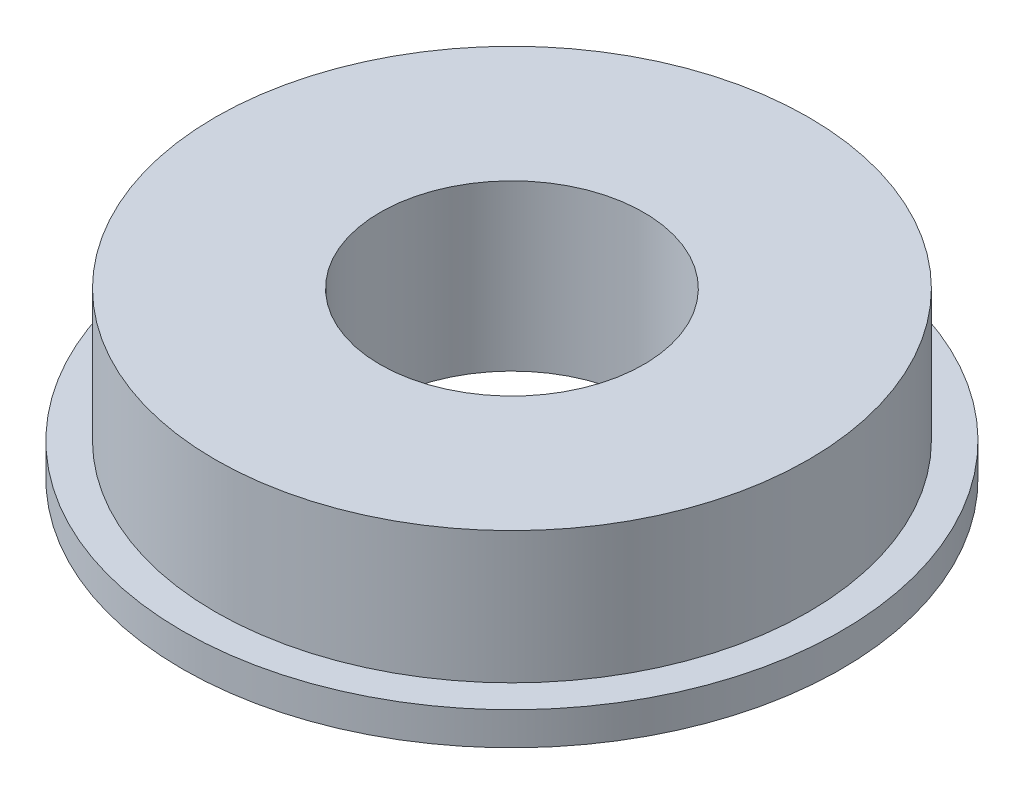
from build123d import *

# Parameters (mm, degrees)
SKETCH1_R           = 15.875
BOSS_EXTRUDE1_DEPTH = 1.5875
SKETCH2_R           = 14.2875
BOSS_EXTRUDE2_DEPTH = 6.35
SKETCH4_R           = 6.35
CUT_EXTRUDE1_DEPTH  = 24.8125


with BuildPart() as part:
    # Sketch1 → Boss-Extrude1 (new body)
    with BuildSketch(Plane(origin=(0, 0, 0), x_dir=(1, 0, 0), z_dir=(0, 1, 0))):
        with Locations(Location((0, 0, 0), (0, 0, 270))):
            Circle(SKETCH1_R)
    extrude(amount=BOSS_EXTRUDE1_DEPTH)

    # Sketch2 → Boss-Extrude2 (add)
    with BuildSketch(Plane(origin=(0, 1.5875, 0), x_dir=(1, 0, 0), z_dir=(0, 1, 0))):
        with Locations(Location((0, 0, 0), (0, 0, 270))):
            Circle(SKETCH2_R)
    extrude(amount=BOSS_EXTRUDE2_DEPTH)

    # Sketch4 → Cut-Extrude1 (cut, through all)
    with BuildSketch(Plane(origin=(0, 7.9375, 0), x_dir=(1, 0, 0), z_dir=(0, 1, 0))):
        with Locations(Location((0, 0, 0), (0, 0, 270))):
            Circle(SKETCH4_R)
    extrude(amount=-CUT_EXTRUDE1_DEPTH, mode=Mode.SUBTRACT)


solid = part.part
